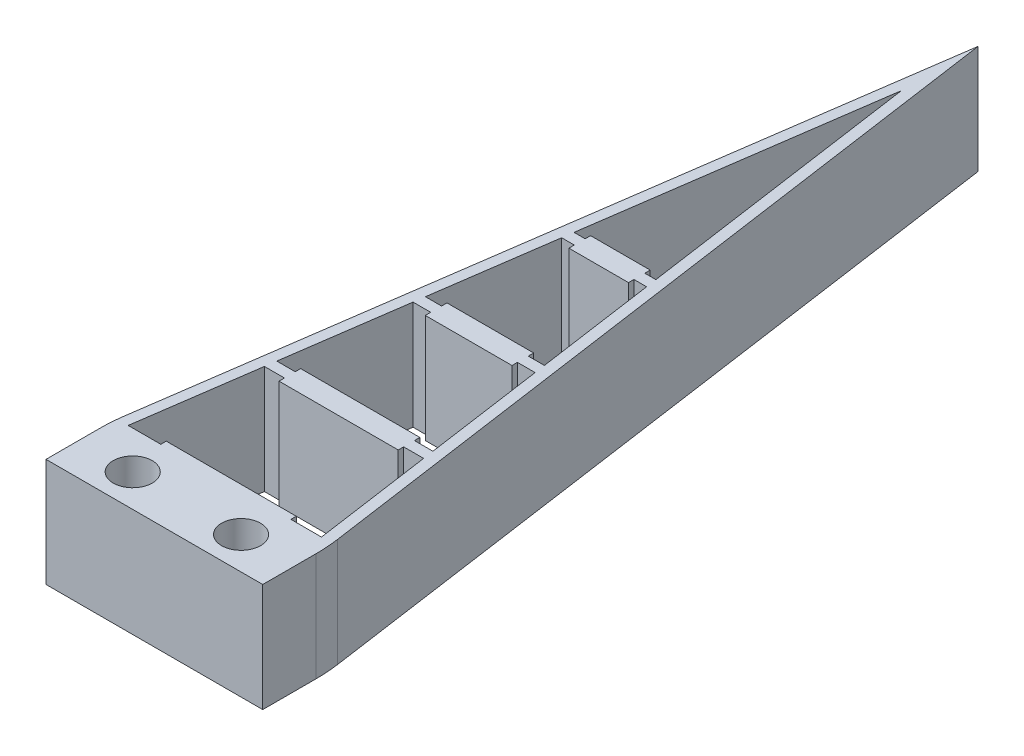
from build123d import *

# Parameters (mm, degrees)
SKETCH1_R           = 1.8
BOSS_EXTRUDE1_DEPTH = 5
FILLET1_R           = 15


with BuildPart() as part:
    # Sketch1 → Boss-Extrude1 (new, symmetric)
    with BuildSketch(Plane(origin=(0, 0, 0), x_dir=(1, 0, 0), z_dir=(0, 1, 0))):
        Polygon((10, -6), (10, 0), (0, 70), (-10, 0), (-10, -6), align=None)
        with Locations(Location((-5, -3, 0), (0, 0, 270))):
            Circle(SKETCH1_R, mode=Mode.SUBTRACT)
        with Locations(Location((5, -3, 0), (0, 0, 270))):
            Circle(SKETCH1_R, mode=Mode.SUBTRACT)
        Polygon((-8.918418884, 0.5), (-7.346990313, 11.5), (-5.5, 11.5), (-5.5, 11), (5.5, 11), (5.5, 11.5), (7.346990313, 11.5), (8.918418884, 0.5), (6.096000551, 0.5), (6.096000551, 1), (-5.903999449, 1), (-5.903999449, 0.5), align=None, mode=Mode.SUBTRACT)
        Polygon((-5.5, 12.5), (-7.20413317, 12.5), (-5.632704598, 23.5), (-4, 23.5), (-4, 23), (4, 23), (4, 23.5), (5.632704598, 23.5), (7.20413317, 12.5), (5.5, 12.5), (5.5, 13), (-5.5, 13), align=None, mode=Mode.SUBTRACT)
        Polygon((-4, 24.5), (-5.489847455, 24.5), (-3.918418884, 35.5), (-2.75, 35.5), (-2.75, 35), (2.75, 35), (2.75, 35.5), (3.918418884, 35.5), (5.489847455, 24.5), (4, 24.5), (4, 25), (-4, 25), align=None, mode=Mode.SUBTRACT)
        Polygon((-3.346933757, 39.500395887), (0, 62.928932188), (3.347561625, 39.496000816), (3.775561741, 36.5), (2.75, 36.5), (2.75, 37), (-2.75, 37), (-2.75, 36.5), (-3.775561741, 36.5), align=None, mode=Mode.SUBTRACT)
    extrude(amount=BOSS_EXTRUDE1_DEPTH, both=True)

    # Fillet1
    fillet1_edges = [part.edges().sort_by_distance(p)[0] for p in [
        (-10, 0, 0),
        (10, 0, 0),
    ]]
    fillet(fillet1_edges, radius=FILLET1_R)


solid = part.part
